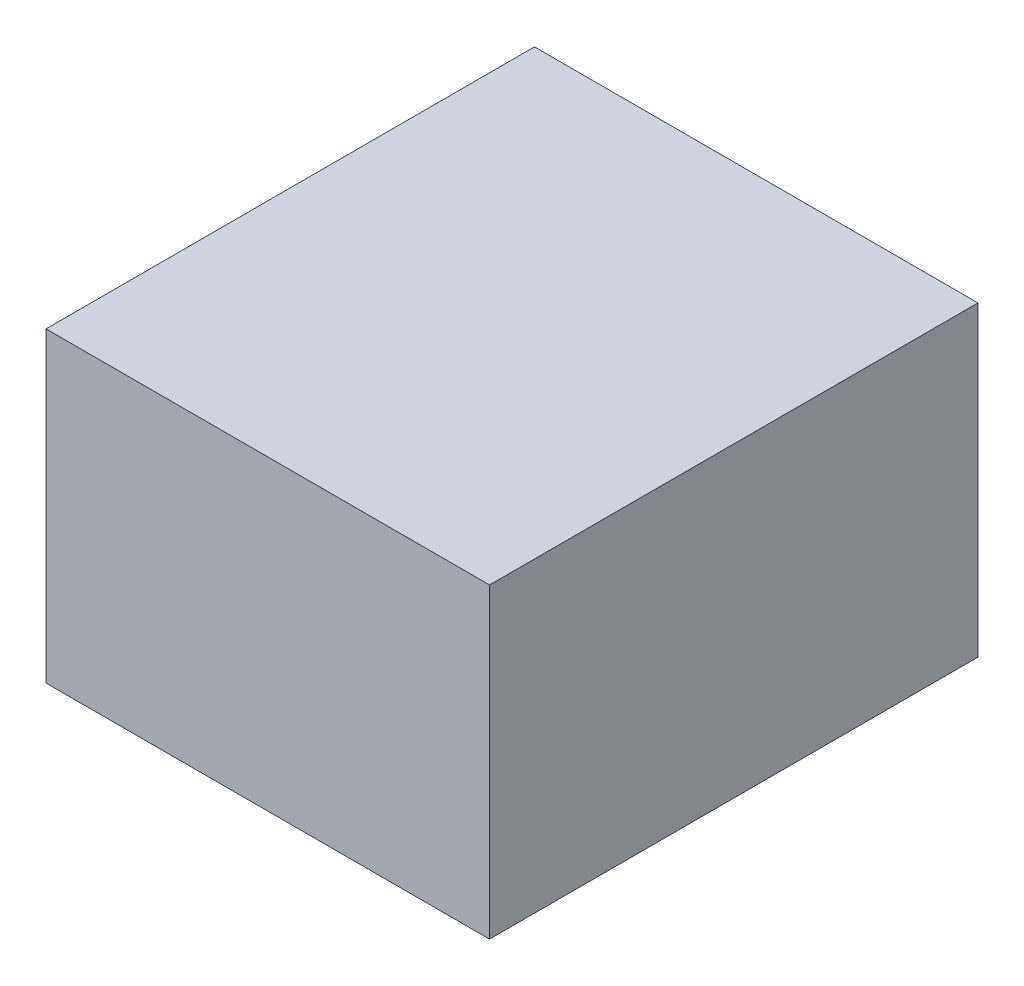
from build123d import *

# Parameters (mm, degrees)
SKETCH1_W           = 90.8
SKETCH1_H           = 100
BOSS_EXTRUDE1_DEPTH = 62.8


with BuildPart() as part:
    # Sketch1 → Boss-Extrude1 (new body)
    with BuildSketch(Plane(origin=(0, 0, 0), x_dir=(1, 0, 0), z_dir=(0, 1, 0))):
        Rectangle(SKETCH1_W, SKETCH1_H)
    extrude(amount=BOSS_EXTRUDE1_DEPTH)


solid = part.part
